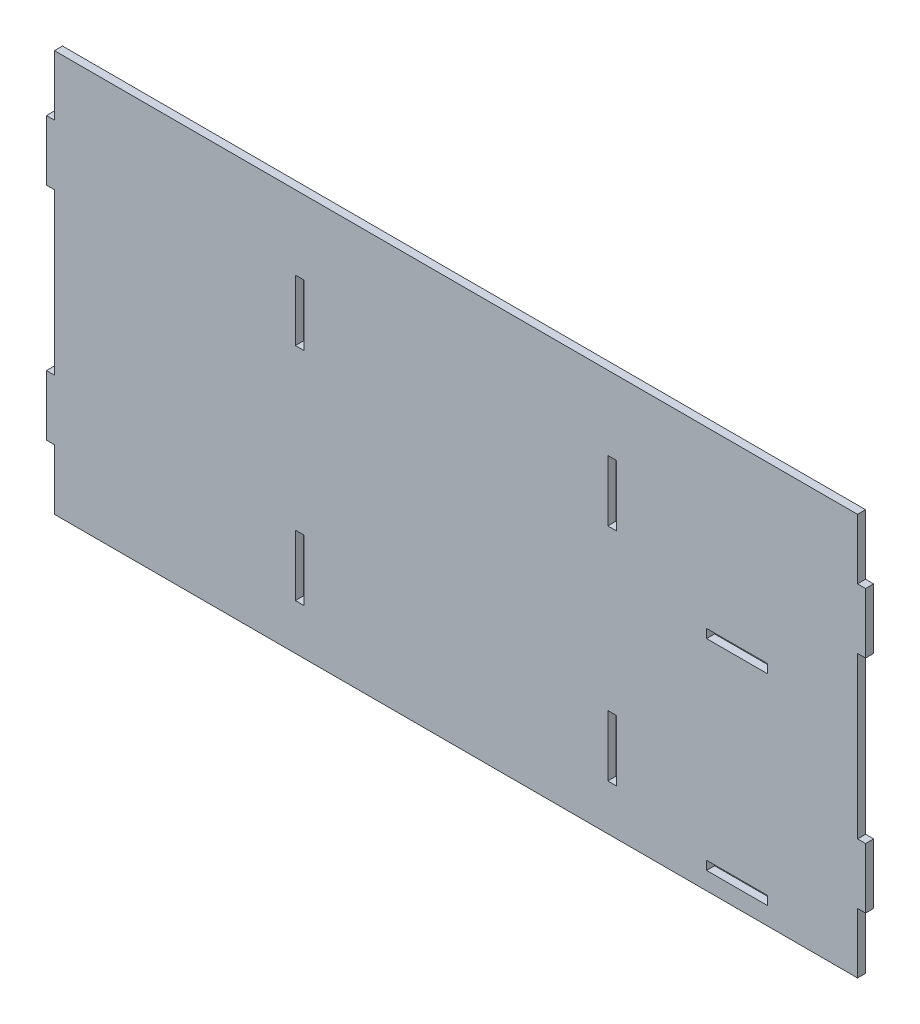
from build123d import *

# Parameters (mm, degrees)
SKETCH_1_W      = 4.4
SKETCH_1_H      = 30.4
SKETCH_1_W_2    = 30.4
SKETCH_1_H_2    = 4.4
EXTRUDE_1_DEPTH = 4


with BuildPart() as part:
    # Эскиз1 → Бобышка-Вытянуть1 (new body)
    with BuildSketch(Plane.XY):
        Polygon((200, 100), (-200, 100), (-200, 70), (-204, 70), (-204, 40), (-200, 40), (-200, -40), (-204, -40), (-204, -70), (-200, -70), (-200, -100), (200, -100), (200, -70), (204, -70), (204, -40), (200, -40), (200, 40), (204, 40), (204, 70), (200, 70), align=None)
        with Locations((-77.8, -62)):
            Rectangle(SKETCH_1_W, SKETCH_1_H, mode=Mode.SUBTRACT)
        with Locations((77.8, -62)):
            Rectangle(SKETCH_1_W, SKETCH_1_H, mode=Mode.SUBTRACT)
        with Locations((140, -89)):
            Rectangle(SKETCH_1_W_2, SKETCH_1_H_2, mode=Mode.SUBTRACT)
        with Locations((-77.8, 48)):
            Rectangle(SKETCH_1_W, SKETCH_1_H, mode=Mode.SUBTRACT)
        with Locations((77.8, 48)):
            Rectangle(SKETCH_1_W, SKETCH_1_H, mode=Mode.SUBTRACT)
        with Locations((140, 11)):
            Rectangle(SKETCH_1_W_2, SKETCH_1_H_2, mode=Mode.SUBTRACT)
    extrude(amount=EXTRUDE_1_DEPTH)


solid = part.part
